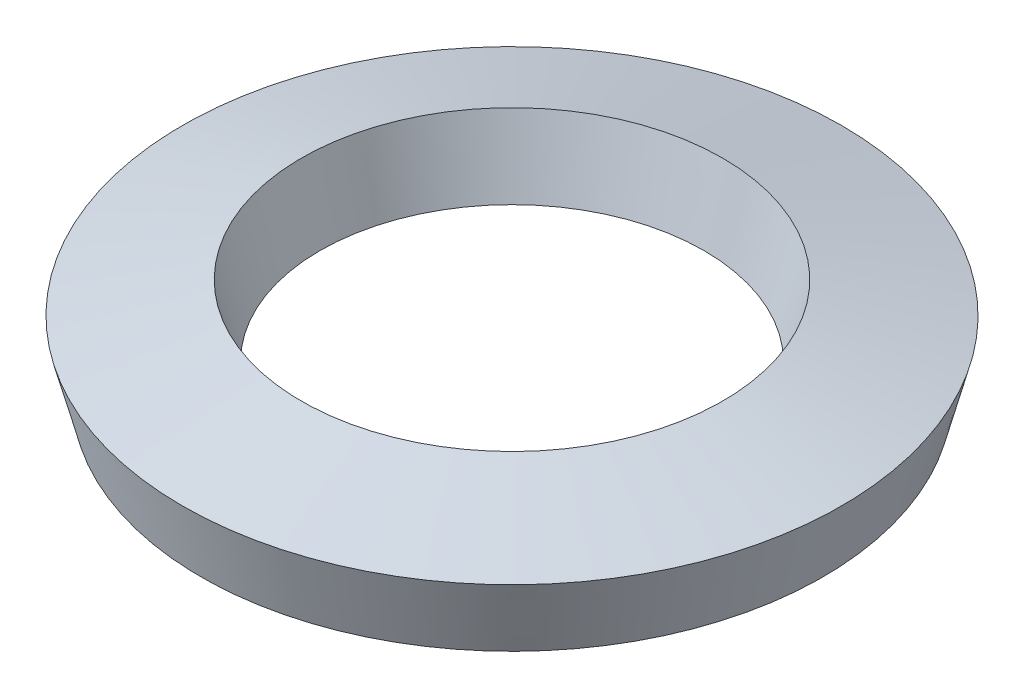
from build123d import *


with BuildPart() as part:
    # Sketch1 → Revolve1 (revolve)
    with BuildSketch(Plane.XY, mode=Mode.PRIVATE) as revolve1_sk:
        Polygon((3.558967227, 0), (2.1971, 0.357697296), (2.410032773, 1.1684), (3.7719, 0.810702704), align=None)
    revolve(revolve1_sk.sketch.rotate(Axis((0, 0, 0), (0, 1, 0)), 90), axis=Axis((0, 0, 0), (0, 1, 0)))


solid = part.part
